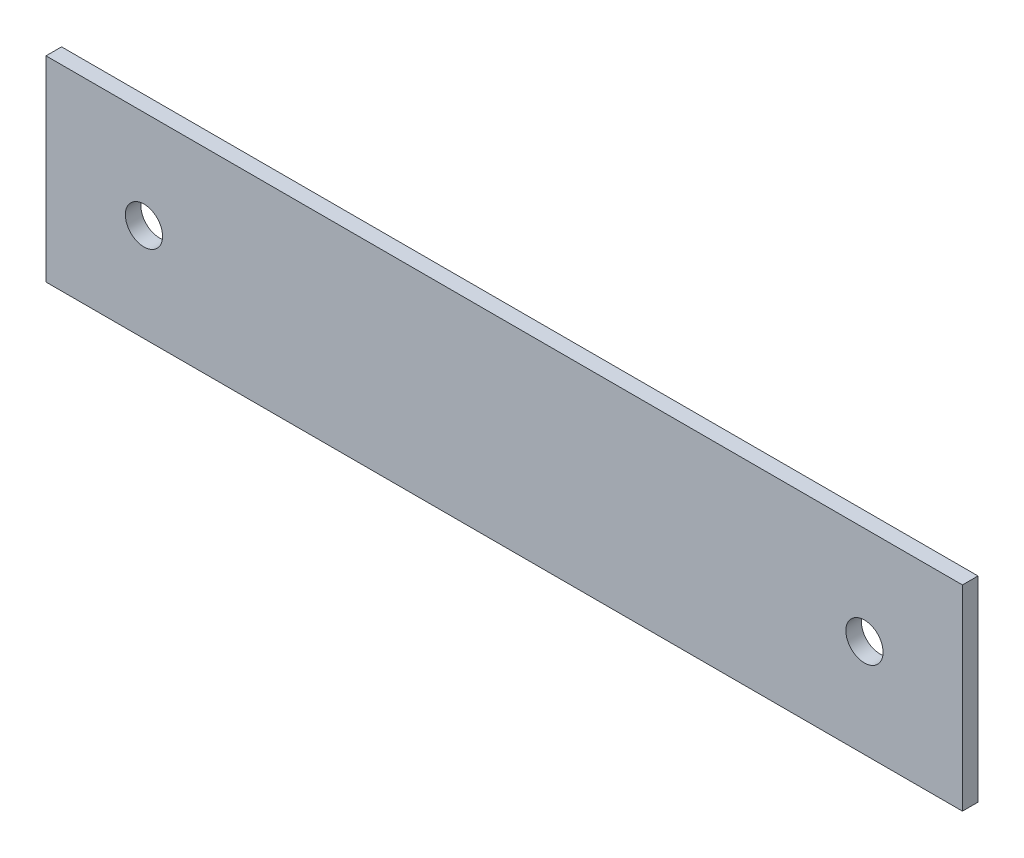
from build123d import *

# Parameters (mm, degrees)
SKETCH1_W             = 93.54
SKETCH1_H             = 20
BOSS_EXTRUDE1_DEPTH   = 1.5875
F_6_CLEARANCE_HOLE1_D = 3.7973


with BuildPart() as part:
    # Sketch1 → Boss-Extrude1 (new body)
    with BuildSketch(Plane.XY):
        Rectangle(SKETCH1_W, SKETCH1_H)
    extrude(amount=BOSS_EXTRUDE1_DEPTH)

    # #6 Clearance Hole1 (through all)
    with Locations(Plane.XY.offset(1.5875)):
        with Locations((-36.77, 0), (36.77, 0)):
            Hole(F_6_CLEARANCE_HOLE1_D / 2)


solid = part.part
